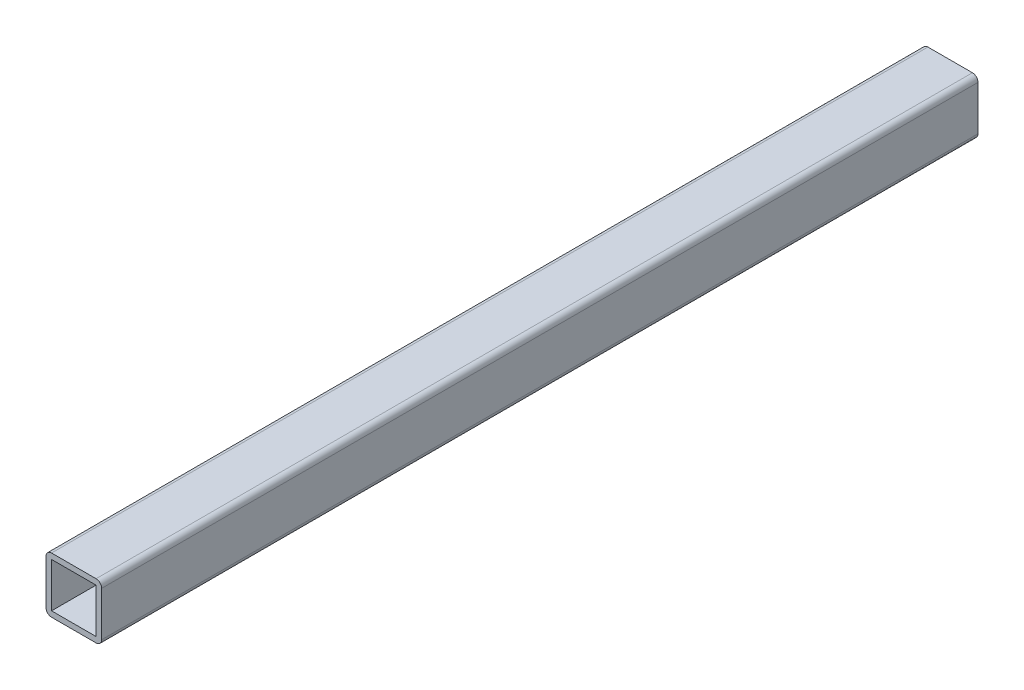
from build123d import *

# Parameters (mm, degrees)
SKETCH1_W           = 20.32
SKETCH1_H           = 20.32
BOSS_EXTRUDE1_DEPTH = 400


with BuildPart() as part:
    # Sketch1 → Boss-Extrude1 (new body)
    with BuildSketch(Plane.XY):
        with BuildLine():
            Line((-10.16, 12.7), (10.16, 12.7))
            ThreePointArc((10.16, 12.7), (11.956051224, 11.956051224), (12.7, 10.16))
            Line((12.7, 10.16), (12.7, -10.16))
            ThreePointArc((12.7, -10.16), (11.956051224, -11.956051224), (10.16, -12.7))
            Line((10.16, -12.7), (-10.16, -12.7))
            ThreePointArc((-10.16, -12.7), (-11.956051224, -11.956051224), (-12.7, -10.16))
            Line((-12.7, -10.16), (-12.7, 10.16))
            ThreePointArc((-12.7, 10.16), (-11.956051224, 11.956051224), (-10.16, 12.7))
        make_face()
        Rectangle(SKETCH1_W, SKETCH1_H, mode=Mode.SUBTRACT)
    extrude(amount=BOSS_EXTRUDE1_DEPTH)


solid = part.part
